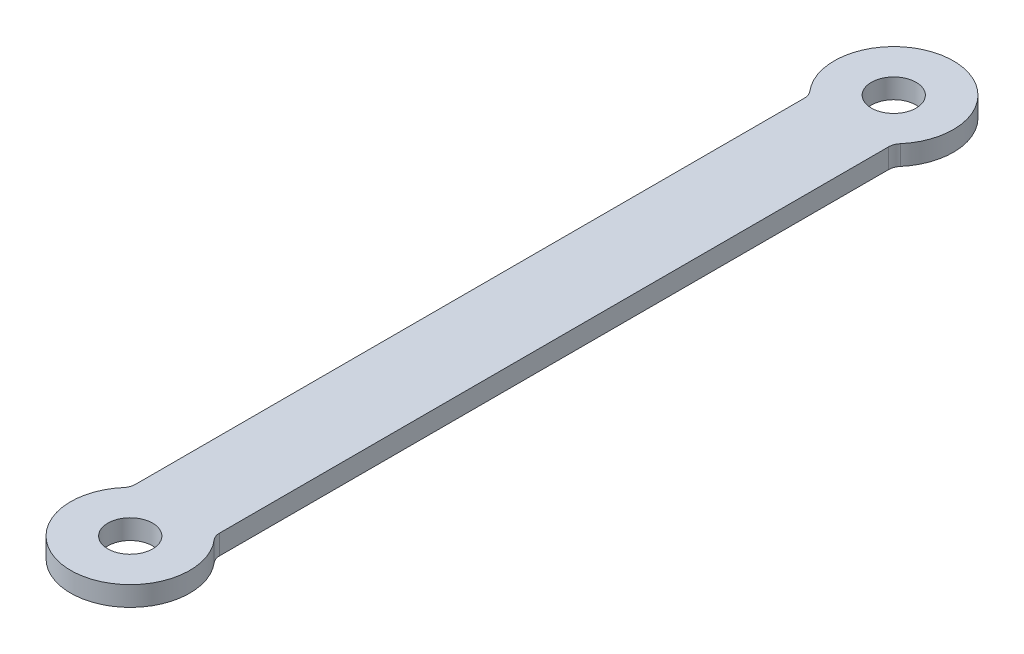
from build123d import *

# Parameters (mm, degrees)
SKETCH2_R            = 4.525
BOSS_EXTRUDE1_DEPTH  = 1.5
M3_CLEARANCE_HOLE1_D = 3.4
FILLET1_R            = 1


with BuildPart() as part:
    # Sketch2 → Boss-Extrude1 (new body)
    with BuildSketch(Plane(origin=(0, 0, 0), x_dir=(1, 0, 0), z_dir=(0, 1, 0))):
        with Locations((0, -29)):
            Circle(SKETCH2_R)
        with BuildLine():
            Line((3.199658185, -25.800341815), (3.199658185, 25.800341815))
            ThreePointArc((3.199658185, 25.800341815), (0, 24.475), (-3.199658185, 25.800341815))
            Line((-3.199658185, 25.800341815), (-3.199658185, -25.800341815))
            ThreePointArc((-3.199658185, -25.800341815), (0, -24.475), (3.199658185, -25.800341815))
        make_face()
        with Locations((0, 29)):
            Circle(SKETCH2_R)
    extrude(amount=BOSS_EXTRUDE1_DEPTH)

    # M3 Clearance Hole1 (through all)
    with Locations(Plane(origin=(0, 1.5, 0), x_dir=(1, 0, 0), z_dir=(0, 1, 0))):
        with Locations((0, 29), (0, -29)):
            Hole(M3_CLEARANCE_HOLE1_D / 2)

    # Fillet1
    fillet1_edges = [part.edges().sort_by_distance(p)[0] for p in [
        (-3.199658185, 0.75, 25.800341815),
        (-3.199658185, 0.75, -25.800341815),
        (3.199658185, 0.75, -25.800341815),
        (3.199658185, 0.75, 25.800341815),
    ]]
    fillet(fillet1_edges, radius=FILLET1_R)


solid = part.part
